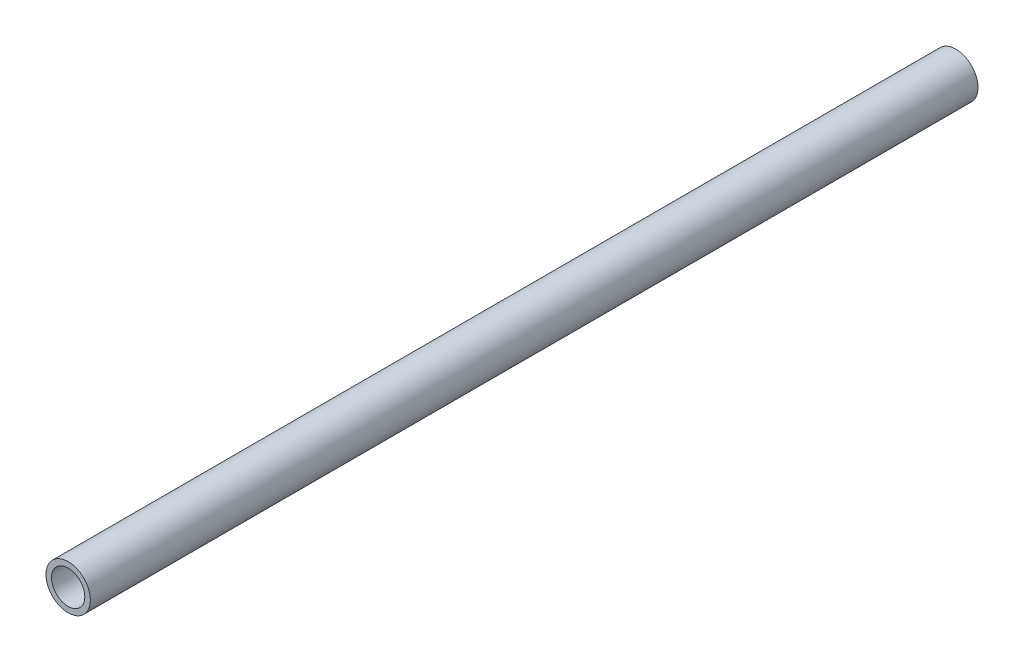
from build123d import *

# Parameters (mm, degrees)
SKETCH1_R           = 6.35
SKETCH1_R_2         = 4.7625
BOSS_EXTRUDE1_DEPTH = 127


with BuildPart() as part:
    # Sketch1 → Boss-Extrude1 (new, symmetric)
    with BuildSketch(Plane.XY):
        Circle(SKETCH1_R)
        Circle(SKETCH1_R_2, mode=Mode.SUBTRACT)
    extrude(amount=BOSS_EXTRUDE1_DEPTH, both=True)


solid = part.part
